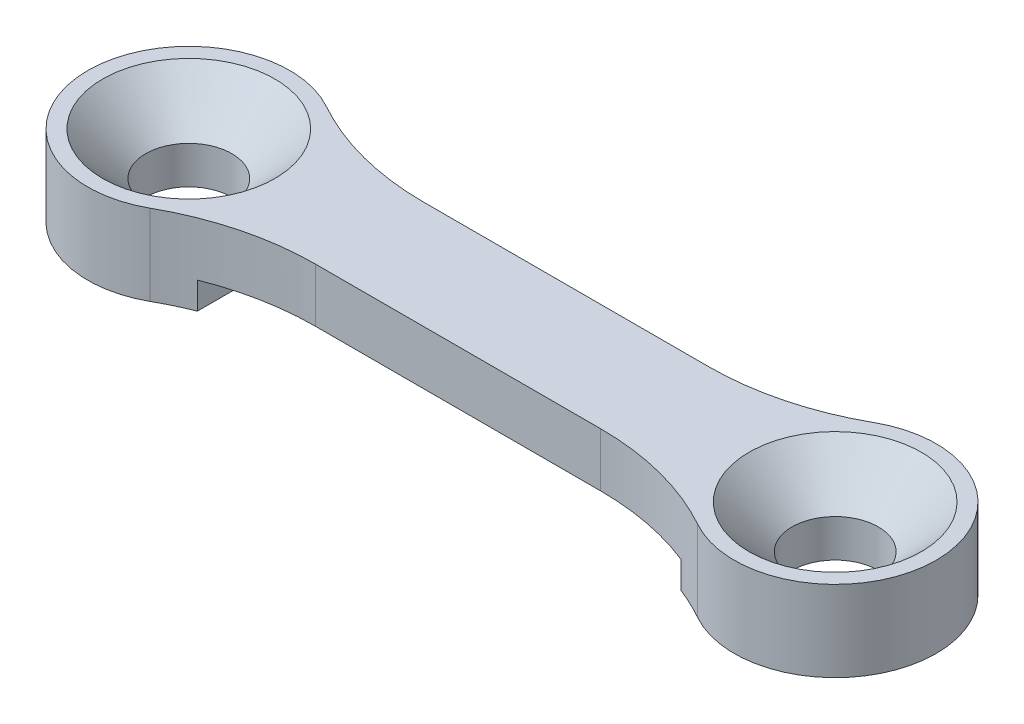
from build123d import *

# Parameters (mm, degrees)
SKETCH1_R           = 1.6
BOSS_EXTRUDE1_DEPTH = 3
CHAMFER1_SIZE       = 1.6
FILLET1_R           = 10
SKETCH2_W           = 17.95
SKETCH2_H           = 5.409714066
CUT_EXTRUDE1_DEPTH  = 1


with BuildPart() as part:
    # Sketch1 → Boss-Extrude1 (new body)
    with BuildSketch(Plane(origin=(0, 0, 0), x_dir=(1, 0, 0), z_dir=(0, 1, 0))):
        with BuildLine():
            Line((8.827855615, 2), (-8.827855615, 2))
            ThreePointArc((-8.827855615, 2), (-15.75, 0), (-8.827855615, -2))
            Line((-8.827855615, -2), (8.827855615, -2))
            ThreePointArc((8.827855615, -2), (15.75, 0), (8.827855615, 2))
        make_face()
        with Locations(Location((-12, 0, 0), (0, 0, 270))):
            Circle(SKETCH1_R, mode=Mode.SUBTRACT)
        with Locations(Location((12, 0, 0), (0, 0, 270))):
            Circle(SKETCH1_R, mode=Mode.SUBTRACT)
    extrude(amount=BOSS_EXTRUDE1_DEPTH)

    # Chamfer1
    chamfer1_edges = [part.edges().sort_by_distance(p)[0] for p in [
        (12, 3, -1.6),
        (-12, 3, -1.6),
    ]]
    chamfer(chamfer1_edges, length=CHAMFER1_SIZE)

    # Fillet1
    fillet1_edges = [part.edges().sort_by_distance(p)[0] for p in [
        (-8.827855615, 1.5, -2),
        (8.827855615, 1.5, -2),
        (8.827855615, 1.5, 2),
        (-8.827855615, 1.5, 2),
    ]]
    fillet(fillet1_edges, radius=FILLET1_R)

    # Sketch2 → Cut-Extrude1 (cut)
    with BuildSketch(Plane(origin=(0, 0, 0), x_dir=(-1, 0, 0), z_dir=(0, -1, 0))):
        Rectangle(SKETCH2_W, SKETCH2_H)
    extrude(amount=-CUT_EXTRUDE1_DEPTH, mode=Mode.SUBTRACT)


solid = part.part
